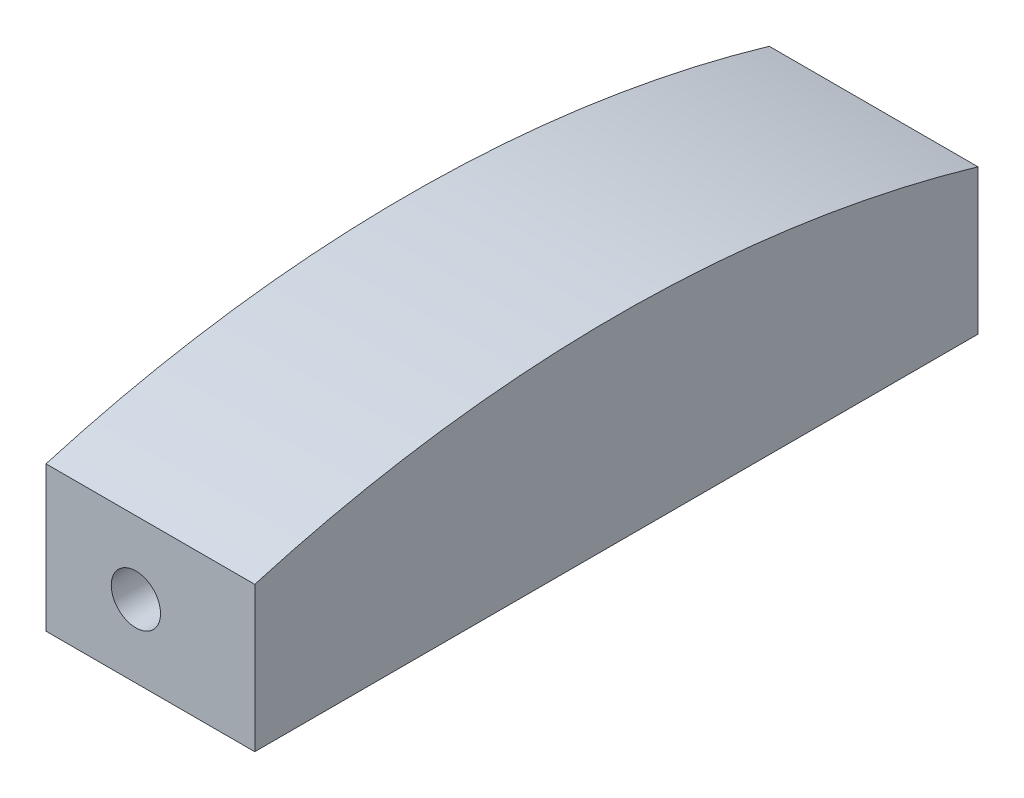
from build123d import *

# Parameters (mm, degrees)
SKETCH1_W               = 18.288
SKETCH1_H               = 63.35702232
SKETCH1_W_2             = 10.16
SKETCH1_H_2             = 5.08
BOSS_EXTRUDE1_DEPTH     = 12.7
BOSS_EXTRUDE2_DEPTH     = 18.288
CUT_EXTRUDE1_DEPTH      = 69.159320254
CUT_EXTRUDE1_DEPTH_BACK = 3.81
SKETCH6_R               = 2.159
CUT_EXTRUDE2_DEPTH      = 69.159320254
CUT_EXTRUDE2_DEPTH_BACK = 3.81
SKETCH9_R               = 2.159
CUT_EXTRUDE3_DEPTH      = 59.834546347
CUT_EXTRUDE3_DEPTH_BACK = 59.834546347
SKETCH10_R              = 1.778


with BuildPart() as part:
    # Sketch1 → Boss-Extrude1 (new body)
    with BuildSketch(Plane(origin=(0, 0, 0), x_dir=(1, 0, 0), z_dir=(0, 1, 0))):
        with Locations((9.144, 31.67851116)):
            Rectangle(SKETCH1_W, SKETCH1_H)
        with Locations((7.874, 55.73702232)):
            Rectangle(SKETCH1_W_2, SKETCH1_H_2, mode=Mode.SUBTRACT)
        with Locations((7.874, 7.62)):
            Rectangle(SKETCH1_W_2, SKETCH1_H_2, mode=Mode.SUBTRACT)
    extrude(amount=BOSS_EXTRUDE1_DEPTH)

    # Sketch2 → Boss-Extrude2 (add)
    with BuildSketch(Plane(origin=(18.288, 0, 0), x_dir=(0, 0, -1), z_dir=(1, 0, 0))):
        with BuildLine():
            Line((0, 12.7), (63.35702232, 12.7))
            ThreePointArc((63.35702232, 12.7), (31.67851116, 17.237450977), (0, 12.7))
        make_face()
    extrude(amount=-BOSS_EXTRUDE2_DEPTH)

    # Sketch6 → Cut-Extrude1 (cut, two sides: drawn at the far end of the back side and taken through both)
    with BuildSketch(Plane.XY.offset(-CUT_EXTRUDE1_DEPTH_BACK)):
        with Locations(Location((7.874, 6.35, 0), (0, 0, 180))):
            Circle(SKETCH6_R)
    extrude(amount=CUT_EXTRUDE1_DEPTH + CUT_EXTRUDE1_DEPTH_BACK, mode=Mode.SUBTRACT)

    # Sketch9 → Cut-Extrude2 (cut, two sides: drawn at the far end of the back side and taken through both)
    with BuildSketch(Plane(origin=(0, 0, -63.35702232), x_dir=(-1, 0, 0), z_dir=(0, 0, -1)).offset(-CUT_EXTRUDE2_DEPTH_BACK)):
        with Locations(Location((-8.128, 6.35, 0), (0, 0, 180))):
            Circle(SKETCH9_R)
    extrude(amount=CUT_EXTRUDE2_DEPTH + CUT_EXTRUDE2_DEPTH_BACK, mode=Mode.SUBTRACT)

    # Sketch10 → Cut-Extrude3 (cut, two sides: drawn at the far end of the back side and taken through both)
    with BuildSketch(Plane(origin=(0, 0, -53.19702232), x_dir=(-1, 0, 0), z_dir=(0, 0, -1)).offset(-CUT_EXTRUDE3_DEPTH_BACK)):
        with Locations((-8.128, 6.35)):
            Circle(SKETCH10_R)
    extrude(amount=CUT_EXTRUDE3_DEPTH + CUT_EXTRUDE3_DEPTH_BACK, mode=Mode.SUBTRACT)


solid = part.part
